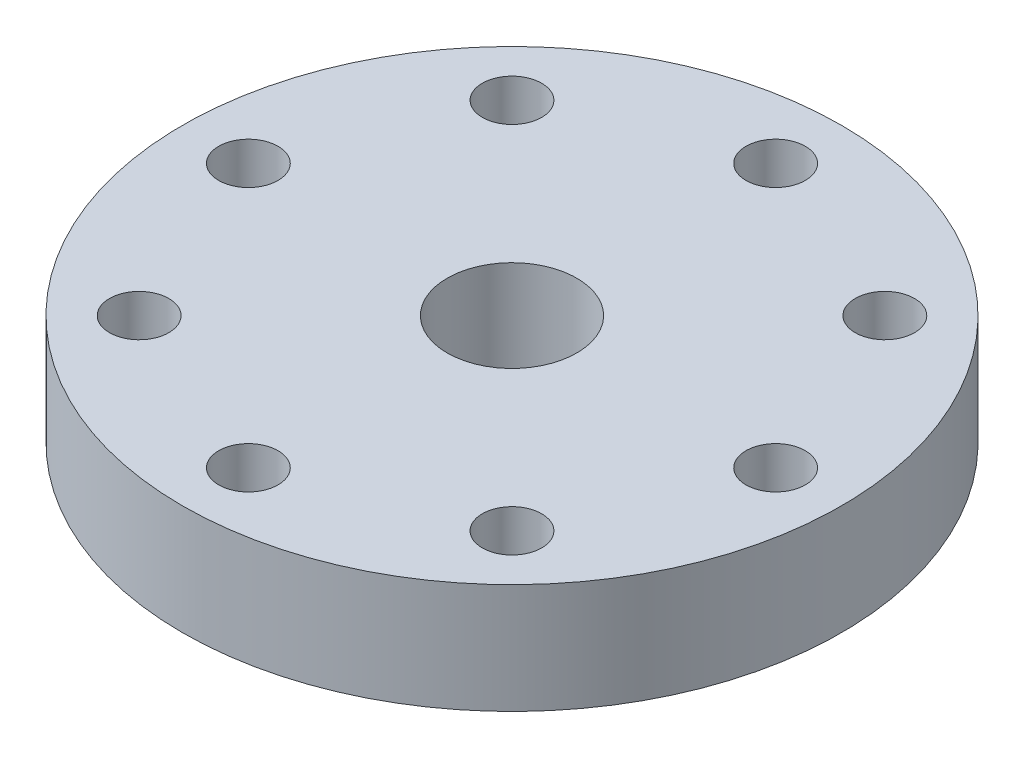
from build123d import *

# Parameters (mm, degrees)
ESQUISSE1_R             = 15
BOSS_EXTRU_1_DEPTH      = 5
ESQUISSE2_R             = 2.95
ENL_V_MAT_EXTRU_1_DEPTH = 22.794494718
D_GAGEMENT_M2_51_D      = 2.7


with BuildPart() as part:
    # Esquisse1 → Boss.-Extru.1 (new body)
    with BuildSketch(Plane(origin=(0, 0, 0), x_dir=(1, 0, 0), z_dir=(0, 1, 0))):
        with Locations(Location((0, 0, 0), (0, 0, 270))):
            Circle(ESQUISSE1_R)
    extrude(amount=BOSS_EXTRU_1_DEPTH)

    # Esquisse2 → Enlèv. mat.-Extru.1 (cut, through all)
    with BuildSketch(Plane(origin=(0, 5, 0), x_dir=(1, 0, 0), z_dir=(0, 1, 0))):
        with Locations(Location((0, 0, 0), (0, 0, 270))):
            Circle(ESQUISSE2_R)
    extrude(amount=-ENL_V_MAT_EXTRU_1_DEPTH, mode=Mode.SUBTRACT)

    # Dégagement M2.51 (through all)
    with Locations(Plane(origin=(0, 5, 0), x_dir=(1, 0, 0), z_dir=(0, 1, 0))):
        with Locations((0, 0), (-12, 0), (-8.485281374, 8.485281374), (0, 12), (8.485281374, 8.485281374), (12, 0), (8.485281374, -8.485281374), (0, -12), (-8.485281374, -8.485281374)):
            Hole(D_GAGEMENT_M2_51_D / 2)


solid = part.part
